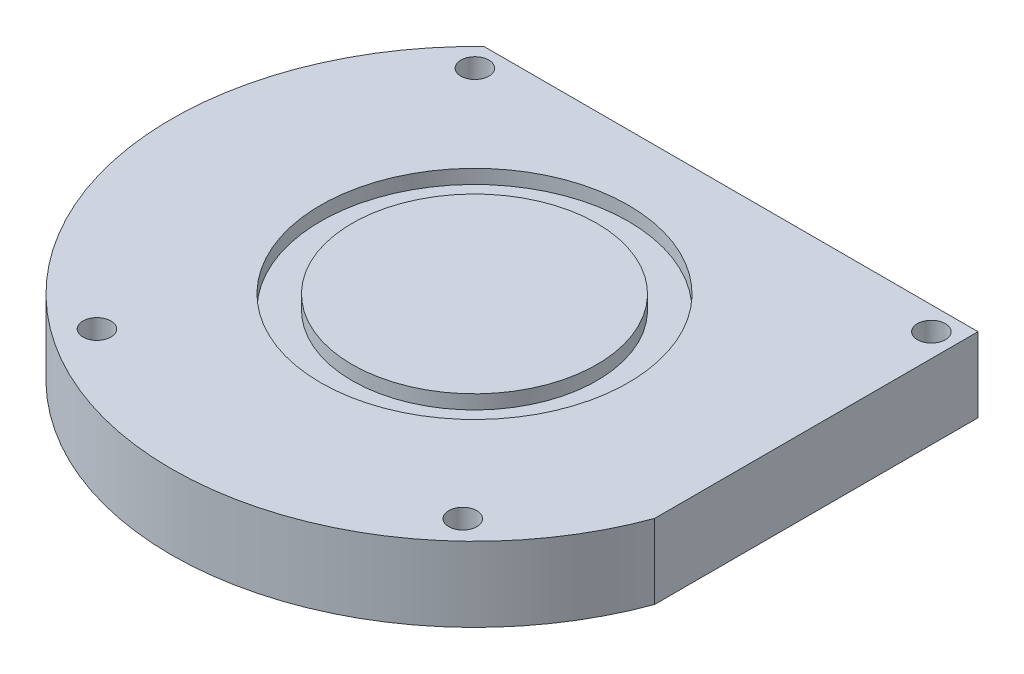
from build123d import *

# Parameters (mm, degrees)
BOSS_EXTRUDE1_DEPTH = 1
CUT_EXTRUDE1_REACH  = 93.929
SKETCH2_R           = 3
SKETCH3_R           = 4
SKETCH3_R_2         = 3
BOSS_EXTRUDE2_DEPTH = 15
BOSS_EXTRUDE3_START = -2
SKETCH4_R           = 3
SKETCH4_R_2         = 1.5
BOSS_EXTRUDE3_DEPTH = 2
BOSS_EXTRUDE4_DEPTH = 15
SKETCH8_R           = 34
SKETCH8_R_2         = 33
SKETCH8_R_3         = 26.25
SKETCH8_R_4         = 25
BOSS_EXTRUDE5_DEPTH = 3
BOSS_EXTRUDE6_START = -1
SKETCH9_R           = 34
BOSS_EXTRUDE6_DEPTH = 1
SKETCH10_R          = 33
SKETCH10_R_2        = 26.25
CUT_EXTRUDE6_DEPTH  = 1


with BuildPart() as part:
    # Sketch1 → Boss-Extrude1 (new body)
    with BuildSketch(Plane(origin=(0, 0, 0), x_dir=(1, 0, 0), z_dir=(0, 1, 0))):
        with BuildLine():
            Line((61.02, 46.990674783), (-44.909648, 46.990674783))
            ThreePointArc((-44.909648, 46.990674783), (-35.615966741, -54.373733669), (61.02, -22.395526339))
            Line((61.02, -22.395526339), (61.02, 46.990674783))
        make_face()
    extrude(amount=BOSS_EXTRUDE1_DEPTH)

    # Sketch2 → Cut-Extrude1 (cut, up to next)
    with BuildSketch(Plane(origin=(0, 1, 0), x_dir=(1, 0, 0), z_dir=(0, 1, 0)), mode=Mode.PRIVATE) as cut_extrude1_sk1:
        with Locations(Location((-41.909648, 41.990674783, 0), (0, 0, 270))):
            Circle(SKETCH2_R)
    cut_extrude1_tool1 = extrude(cut_extrude1_sk1.sketch, amount=-CUT_EXTRUDE1_REACH, mode=Mode.PRIVATE) & part.part
    # Sketch2 → Cut-Extrude1 (cut, up to next)
    with BuildSketch(Plane(origin=(0, 1, 0), x_dir=(1, 0, 0), z_dir=(0, 1, 0)), mode=Mode.PRIVATE) as cut_extrude1_sk2:
        with Locations(Location((56.02, 41.990674783, 0), (0, 0, 270))):
            Circle(SKETCH2_R)
    cut_extrude1_tool2 = extrude(cut_extrude1_sk2.sketch, amount=-CUT_EXTRUDE1_REACH, mode=Mode.PRIVATE) & part.part
    # Sketch2 → Cut-Extrude1 (cut, up to next)
    with BuildSketch(Plane(origin=(0, 1, 0), x_dir=(1, 0, 0), z_dir=(0, 1, 0)), mode=Mode.PRIVATE) as cut_extrude1_sk3:
        with Locations(Location((40.5, -43.009325217, 0), (0, 0, 270))):
            Circle(SKETCH2_R)
    cut_extrude1_tool3 = extrude(cut_extrude1_sk3.sketch, amount=-CUT_EXTRUDE1_REACH, mode=Mode.PRIVATE) & part.part
    # Sketch2 → Cut-Extrude1 (cut, up to next)
    with BuildSketch(Plane(origin=(0, 1, 0), x_dir=(1, 0, 0), z_dir=(0, 1, 0)), mode=Mode.PRIVATE) as cut_extrude1_sk4:
        with Locations(Location((-33.98, -47.009325217, 0), (0, 0, 270))):
            Circle(SKETCH2_R)
    cut_extrude1_tool4 = extrude(cut_extrude1_sk4.sketch, amount=-CUT_EXTRUDE1_REACH, mode=Mode.PRIVATE) & part.part
    add(cut_extrude1_tool1.solids().sort_by_distance((-41.909648, 1, -41.990675))[0], mode=Mode.SUBTRACT)
    add(cut_extrude1_tool2.solids().sort_by_distance((56.02, 1, -41.990675))[0], mode=Mode.SUBTRACT)
    add(cut_extrude1_tool3.solids().sort_by_distance((40.5, 1, 43.009325))[0], mode=Mode.SUBTRACT)
    add(cut_extrude1_tool4.solids().sort_by_distance((-33.98, 1, 47.009325))[0], mode=Mode.SUBTRACT)

    # Sketch3 → Boss-Extrude2 (add)
    # profile 1 of 4: a face of its own
    with BuildSketch(Plane.XZ):
        with Locations(Location((56.02, -41.990674783, 0), (0, 0, 90))):
            Circle(SKETCH3_R)
        with Locations(Location((56.02, -41.990674783, 0), (0, 0, 90))):
            Circle(SKETCH3_R_2, mode=Mode.SUBTRACT)
    # profile 2 of 4: a face of its own
    with BuildSketch(Plane.XZ):
        with Locations(Location((-41.909648, -41.990674783, 0), (0, 0, 90))):
            Circle(SKETCH3_R)
        with Locations(Location((-41.909648, -41.990674783, 0), (0, 0, 90))):
            Circle(SKETCH3_R_2, mode=Mode.SUBTRACT)
    # profile 3 of 4: a face of its own
    with BuildSketch(Plane.XZ):
        with Locations(Location((40.5, 43.009325217, 0), (0, 0, 90))):
            Circle(SKETCH3_R)
        with Locations(Location((40.5, 43.009325217, 0), (0, 0, 90))):
            Circle(SKETCH3_R_2, mode=Mode.SUBTRACT)
    # profile 4 of 4: a face of its own
    with BuildSketch(Plane.XZ):
        with Locations(Location((-33.98, 47.009325217, 0), (0, 0, 90))):
            Circle(SKETCH3_R)
        with Locations(Location((-33.98, 47.009325217, 0), (0, 0, 90))):
            Circle(SKETCH3_R_2, mode=Mode.SUBTRACT)
    extrude(amount=BOSS_EXTRUDE2_DEPTH)

    # Sketch4 → Boss-Extrude3 (add)
    # profile 1 of 4: a face of its own
    with BuildSketch(Plane.XZ.offset(15).offset(BOSS_EXTRUDE3_START)):
        with Locations(Location((56.02, -41.990674783, 0), (0, 0, 90))):
            Circle(SKETCH4_R)
        with Locations(Location((56.02, -41.990674783, 0), (0, 0, 270))):
            Circle(SKETCH4_R_2, mode=Mode.SUBTRACT)
    # profile 2 of 4: a face of its own
    with BuildSketch(Plane.XZ.offset(15).offset(BOSS_EXTRUDE3_START)):
        with Locations(Location((-41.909648, -41.990674783, 0), (0, 0, 90))):
            Circle(SKETCH4_R)
        with Locations(Location((-41.909648, -41.990674783, 0), (0, 0, 270))):
            Circle(SKETCH4_R_2, mode=Mode.SUBTRACT)
    # profile 3 of 4: a face of its own
    with BuildSketch(Plane.XZ.offset(15).offset(BOSS_EXTRUDE3_START)):
        with Locations(Location((-33.98, 47.009325217, 0), (0, 0, 90))):
            Circle(SKETCH4_R)
        with Locations(Location((-33.98, 47.009325217, 0), (0, 0, 270))):
            Circle(SKETCH4_R_2, mode=Mode.SUBTRACT)
    # profile 4 of 4: a face of its own
    with BuildSketch(Plane.XZ.offset(15).offset(BOSS_EXTRUDE3_START)):
        with Locations(Location((40.5, 43.009325217, 0), (0, 0, 90))):
            Circle(SKETCH4_R)
        with Locations(Location((40.5, 43.009325217, 0), (0, 0, 270))):
            Circle(SKETCH4_R_2, mode=Mode.SUBTRACT)
    extrude(amount=BOSS_EXTRUDE3_DEPTH)

    # Sketch5 → Boss-Extrude4 (add)
    with BuildSketch(Plane.XZ):
        with BuildLine():
            Line((61.02, -46.990674783), (-44.909648, -46.990674783))
            ThreePointArc((-44.909648, -46.990674783), (-35.615966741, 54.373733669), (61.02, 22.395526339))
            Line((61.02, 22.395526339), (61.02, -46.990674783))
        make_face()
        with BuildLine():
            Line((-38.445546385, -43.990674783), (52.555898385, -43.990674783))
            ThreePointArc((52.555898385, -43.990674783), (58.848427125, -44.819101907), (58.02, -38.526573168))
            Line((58.02, -38.526573168), (58.02, 21.855882503))
            ThreePointArc((58.02, 21.855882503), (52.354897092, 33.210913123), (44.496580109, 43.174695814))
            ThreePointArc((44.496580109, 43.174695814), (43.242199594, 45.921427789), (40.425106883, 47.008624034))
            ThreePointArc((40.425106883, 47.008624034), (2.711724037, 61.940669618), (-36.162300139, 50.361573136))
            ThreePointArc((-36.162300139, 50.361573136), (-36.323268199, 50.25109852), (-36.478654103, 50.132901321))
            ThreePointArc((-36.478654103, 50.132901321), (-61.676302569, 6.327219087), (-45.897728888, -41.682112265))
            ThreePointArc((-45.897728888, -41.682112265), (-43.093288061, -45.811538063), (-38.445546385, -43.990674783))
        make_face(mode=Mode.SUBTRACT)
    extrude(amount=BOSS_EXTRUDE4_DEPTH)

    # Sketch8 → Boss-Extrude5 (add)
    # profile 1 of 2: a face of its own
    with BuildSketch(Plane(origin=(0, 0, 0), x_dir=(1, 0, 0), z_dir=(0, 1, 0))):
        with Locations(Location((0, 0, 0), (0, 0, 90))):
            Circle(SKETCH8_R)
        with Locations(Location((0, 0, 0), (0, 0, 270))):
            Circle(SKETCH8_R_2, mode=Mode.SUBTRACT)
    # profile 2 of 2: a face of its own
    with BuildSketch(Plane(origin=(0, 0, 0), x_dir=(1, 0, 0), z_dir=(0, 1, 0))):
        with Locations(Location((0, 0, 0), (0, 0, 90))):
            Circle(SKETCH8_R_3)
        with Locations(Location((0, 0, 0), (0, 0, 270))):
            Circle(SKETCH8_R_4, mode=Mode.SUBTRACT)
    extrude(amount=-BOSS_EXTRUDE5_DEPTH)

    # Sketch9 → Boss-Extrude6 (add)
    with BuildSketch(Plane.XZ.offset(3).offset(BOSS_EXTRUDE6_START)):
        with Locations(Location((0, 0, 0), (0, 0, 270))):
            Circle(SKETCH9_R)
    extrude(amount=BOSS_EXTRUDE6_DEPTH)

    # Sketch10 → Cut-Extrude6 (cut)
    with BuildSketch(Plane(origin=(0, 1, 0), x_dir=(1, 0, 0), z_dir=(0, 1, 0))):
        with Locations(Location((0, 0, 0), (0, 0, 270))):
            Circle(SKETCH10_R)
        with Locations(Location((0, 0, 0), (0, 0, 270))):
            Circle(SKETCH10_R_2, mode=Mode.SUBTRACT)
    extrude(amount=-CUT_EXTRUDE6_DEPTH, mode=Mode.SUBTRACT)


solid = part.part
